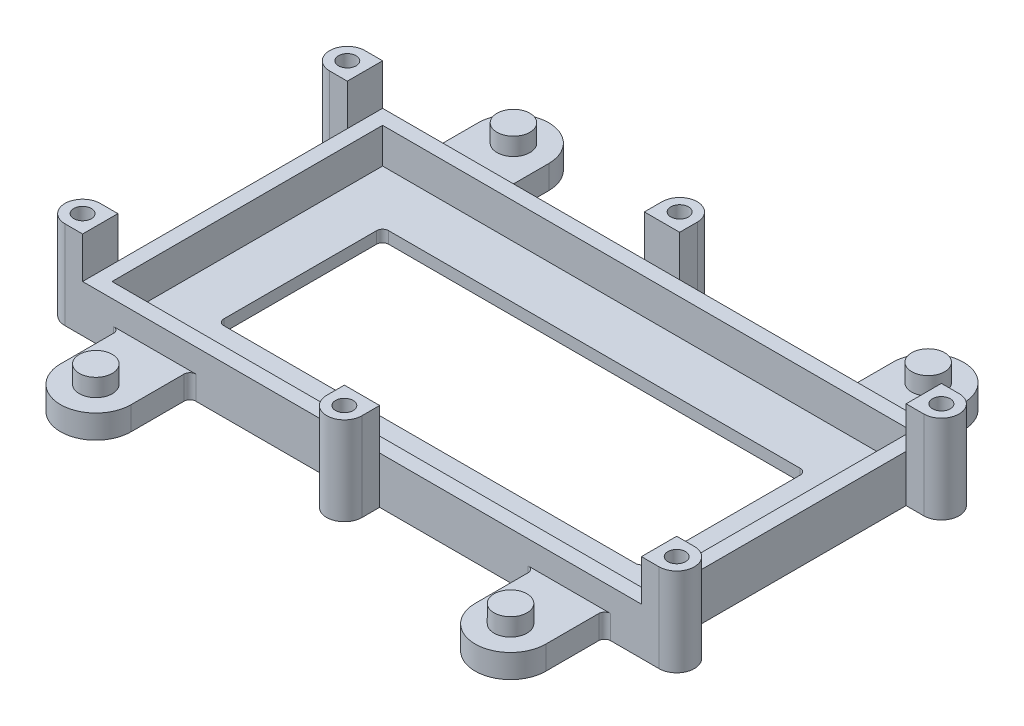
from build123d import *

# Parameters (mm, degrees)
SKETCH1_W           = 95
SKETCH1_H           = 51
BOSS_EXTRUDE1_DEPTH = 2
SKETCH2_W           = 95
SKETCH2_H           = 51
SKETCH2_W_2         = 90
SKETCH2_H_2         = 46
BOSS_EXTRUDE2_DEPTH = 6
SKETCH3_W           = 72
SKETCH3_H           = 28
CUT_EXTRUDE1_DEPTH  = 63.03729958
BOSS_EXTRUDE3_DEPTH = 4
SKETCH6_R           = 2.8
BOSS_EXTRUDE4_DEPTH = 3
SKETCH8_R           = 1.5
BOSS_EXTRUDE6_DEPTH = 15
FILLET1_R           = 1


with BuildPart() as part:
    # Sketch1 → Boss-Extrude1 (new body)
    with BuildSketch(Plane(origin=(0, 0, 0), x_dir=(1, 0, 0), z_dir=(0, 1, 0))):
        with Locations((-8.42936803, 0.663568773)):
            Rectangle(SKETCH1_W, SKETCH1_H)
    extrude(amount=BOSS_EXTRUDE1_DEPTH)

    # Sketch2 → Boss-Extrude2 (add)
    with BuildSketch(Plane(origin=(0, 2, 0), x_dir=(1, 0, 0), z_dir=(0, 1, 0))):
        with Locations((-8.42936803, 0.663568773)):
            Rectangle(SKETCH2_W, SKETCH2_H)
        with Locations((-8.42936803, 0.663568773)):
            Rectangle(SKETCH2_W_2, SKETCH2_H_2, mode=Mode.SUBTRACT)
    extrude(amount=BOSS_EXTRUDE2_DEPTH)

    # Sketch3 → Cut-Extrude1 (cut, through all)
    with BuildSketch(Plane(origin=(0, 2, 0), x_dir=(1, 0, 0), z_dir=(0, 1, 0))):
        with Locations((-8.42936803, 0.663568773)):
            Rectangle(SKETCH3_W, SKETCH3_H)
    extrude(amount=-CUT_EXTRUDE1_DEPTH, mode=Mode.SUBTRACT)

    # Sketch5 → Boss-Extrude3 (add)
    with BuildSketch(Plane.XZ):
        with BuildLine():
            Line((-49.67936803, -26.163568773), (-37.67936803, -26.163568773))
            Line((-37.67936803, -26.163568773), (-37.67936803, -36.163568773))
            ThreePointArc((-37.67936803, -36.163568773), (-43.67936803, -42.163568773), (-49.67936803, -36.163568773))
            Line((-49.67936803, -36.163568773), (-49.67936803, -26.163568773))
        make_face()
        with BuildLine():
            Line((-49.67936803, 24.836431227), (-49.67936803, 34.836431227))
            ThreePointArc((-49.67936803, 34.836431227), (-43.67936803, 40.836431227), (-37.67936803, 34.836431227))
            Line((-37.67936803, 34.836431227), (-37.67936803, 24.836431227))
            Line((-37.67936803, 24.836431227), (-49.67936803, 24.836431227))
        make_face()
        with BuildLine():
            Line((32.82063197, -26.163568773), (32.82063197, -36.163568773))
            ThreePointArc((32.82063197, -36.163568773), (26.82063197, -42.163568773), (20.82063197, -36.163568773))
            Line((20.82063197, -36.163568773), (20.82063197, -26.163568773))
            Line((20.82063197, -26.163568773), (32.82063197, -26.163568773))
        make_face()
        with BuildLine():
            Line((32.82063197, 24.836431227), (20.82063197, 24.836431227))
            Line((20.82063197, 24.836431227), (20.82063197, 34.836431227))
            ThreePointArc((20.82063197, 34.836431227), (26.82063197, 40.836431227), (32.82063197, 34.836431227))
            Line((32.82063197, 34.836431227), (32.82063197, 24.836431227))
        make_face()
    extrude(amount=-BOSS_EXTRUDE3_DEPTH)

    # Sketch6 → Boss-Extrude4 (add)
    with BuildSketch(Plane(origin=(0, 4, 0), x_dir=(1, 0, 0), z_dir=(0, 1, 0))):
        with Locations(Location((-43.67936803, 36.163568773, 0), (0, 0, 90))):
            Circle(SKETCH6_R)
        with Locations(Location((26.82063197, 36.163568773, 0), (0, 0, 270))):
            Circle(SKETCH6_R)
        with Locations(Location((26.82063197, -34.836431227, 0), (0, 0, 90))):
            Circle(SKETCH6_R)
        with Locations(Location((-43.67936803, -34.836431227, 0), (0, 0, 270))):
            Circle(SKETCH6_R)
    extrude(amount=BOSS_EXTRUDE4_DEPTH)

    # Sketch8 → Boss-Extrude6 (add)
    # profile 1 of 6: a face of its own
    with BuildSketch(Plane.XZ):
        with BuildLine():
            Line((-55.92936803, 24.836431227), (-58.92936803, 24.836431227))
            ThreePointArc((-58.92936803, 24.836431227), (-61.92936803, 21.836431227), (-58.92936803, 18.836431227))
            Line((-58.92936803, 18.836431227), (-55.92936803, 18.836431227))
            Line((-55.92936803, 18.836431227), (-55.92936803, 24.836431227))
        make_face()
        with Locations(Location((-58.92936803, 21.836431227, 0), (0, 0, 270))):
            Circle(SKETCH8_R, mode=Mode.SUBTRACT)
    # profile 2 of 6: a face of its own
    with BuildSketch(Plane.XZ):
        with BuildLine():
            Line((-5.42936803, -26.163568773), (-5.42936803, -29.163568773))
            ThreePointArc((-5.42936803, -29.163568773), (-8.42936803, -32.163568773), (-11.42936803, -29.163568773))
            Line((-11.42936803, -29.163568773), (-11.42936803, -26.163568773))
            Line((-11.42936803, -26.163568773), (-5.42936803, -26.163568773))
        make_face()
        with Locations(Location((-8.42936803, -29.163568773, 0), (0, 0, 90))):
            Circle(SKETCH8_R, mode=Mode.SUBTRACT)
    # profile 3 of 6: a face of its own
    with BuildSketch(Plane.XZ):
        with BuildLine():
            Line((-55.92936803, -20.163568773), (-58.92936803, -20.163568773))
            ThreePointArc((-58.92936803, -20.163568773), (-61.92936803, -23.163568773), (-58.92936803, -26.163568773))
            Line((-58.92936803, -26.163568773), (-55.92936803, -26.163568773))
            Line((-55.92936803, -26.163568773), (-55.92936803, -20.163568773))
        make_face()
        with Locations(Location((-58.92936803, -23.163568773, 0), (0, 0, 90))):
            Circle(SKETCH8_R, mode=Mode.SUBTRACT)
    # profile 4 of 6: a face of its own
    with BuildSketch(Plane.XZ):
        with BuildLine():
            Line((39.07063197, -26.163568773), (42.07063197, -26.163568773))
            ThreePointArc((42.07063197, -26.163568773), (45.07063197, -23.163568773), (42.07063197, -20.163568773))
            Line((42.07063197, -20.163568773), (39.07063197, -20.163568773))
            Line((39.07063197, -20.163568773), (39.07063197, -26.163568773))
        make_face()
        with Locations(Location((42.07063197, -23.163568773, 0), (0, 0, 270))):
            Circle(SKETCH8_R, mode=Mode.SUBTRACT)
    # profile 5 of 6: a face of its own
    with BuildSketch(Plane.XZ):
        with BuildLine():
            Line((39.07063197, 18.836431227), (42.07063197, 18.836431227))
            ThreePointArc((42.07063197, 18.836431227), (45.07063197, 21.836431227), (42.07063197, 24.836431227))
            Line((42.07063197, 24.836431227), (39.07063197, 24.836431227))
            Line((39.07063197, 24.836431227), (39.07063197, 18.836431227))
        make_face()
        with Locations(Location((42.07063197, 21.836431227, 0), (0, 0, 90))):
            Circle(SKETCH8_R, mode=Mode.SUBTRACT)
    # profile 6 of 6: a face of its own
    with BuildSketch(Plane.XZ):
        with BuildLine():
            Line((-11.42936803, 24.836431227), (-5.42936803, 24.836431227))
            Line((-5.42936803, 24.836431227), (-5.42936803, 27.836431227))
            ThreePointArc((-5.42936803, 27.836431227), (-8.42936803, 30.836431227), (-11.42936803, 27.836431227))
            Line((-11.42936803, 27.836431227), (-11.42936803, 24.836431227))
        make_face()
        with Locations(Location((-8.42936803, 27.836431227, 0), (0, 0, 270))):
            Circle(SKETCH8_R, mode=Mode.SUBTRACT)
    extrude(amount=-BOSS_EXTRUDE6_DEPTH)

    # Fillet1
    fillet1_edges = [part.edges().sort_by_distance(p)[0] for p in [
        (-44.42936803, 1, 13.336431227),
        (-44.42936803, 1, -14.663568773),
        (27.57063197, 1, -14.663568773),
        (27.57063197, 1, 13.336431227),
        (-49.67936803, 2, -26.163568773),
        (-37.67936803, 2, -26.163568773),
        (-37.67936803, 2, 24.836431227),
        (-49.67936803, 2, 24.836431227),
        (20.82063197, 2, -26.163568773),
        (32.82063197, 2, -26.163568773),
        (32.82063197, 2, 24.836431227),
        (20.82063197, 2, 24.836431227),
    ]]
    fillet(fillet1_edges, radius=FILLET1_R)


solid = part.part
